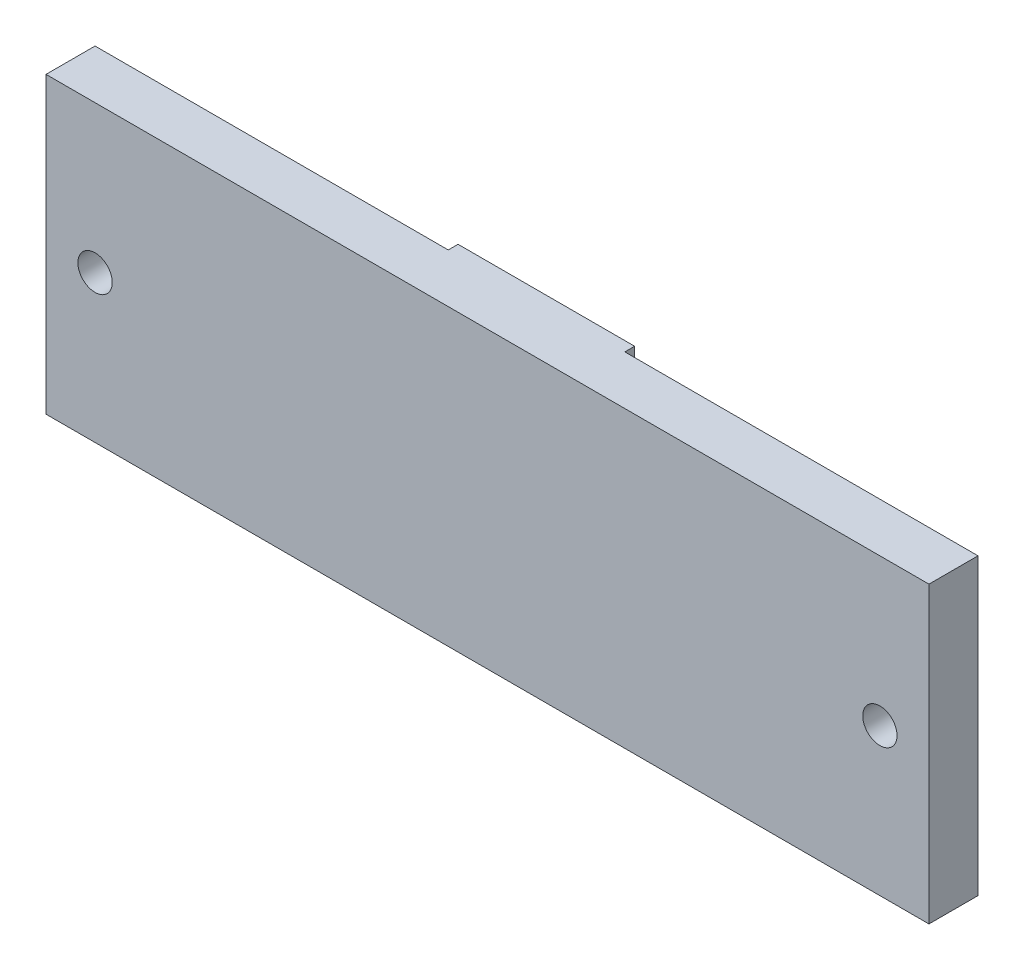
from build123d import *

# Parameters (mm, degrees)
SKETCH1_W           = 90
SKETCH1_H           = 30
BOSS_EXTRUDE1_DEPTH = 5
SKETCH2_R           = 1.75
CUT_EXTRUDE1_DEPTH  = 55.313902456
SKETCH3_W           = 18
SKETCH3_H           = 30
BOSS_EXTRUDE2_DEPTH = 1


with BuildPart() as part:
    # Sketch1 → Boss-Extrude1 (new body)
    with BuildSketch(Plane.XY):
        with Locations((0, -15)):
            Rectangle(SKETCH1_W, SKETCH1_H)
    extrude(amount=BOSS_EXTRUDE1_DEPTH)

    # Sketch2 → Cut-Extrude1 (cut, through all)
    with BuildSketch(Plane.XY.offset(5)):
        with Locations((40, -15)):
            Circle(SKETCH2_R)
        with Locations((-40, -15)):
            Circle(SKETCH2_R)
    extrude(amount=-CUT_EXTRUDE1_DEPTH, mode=Mode.SUBTRACT)

    # Sketch3 → Boss-Extrude2 (add)
    with BuildSketch(Plane(origin=(0, 0, 0), x_dir=(-1, 0, 0), z_dir=(0, 0, -1))):
        with Locations((0, -15)):
            Rectangle(SKETCH3_W, SKETCH3_H)
    extrude(amount=BOSS_EXTRUDE2_DEPTH)


solid = part.part
